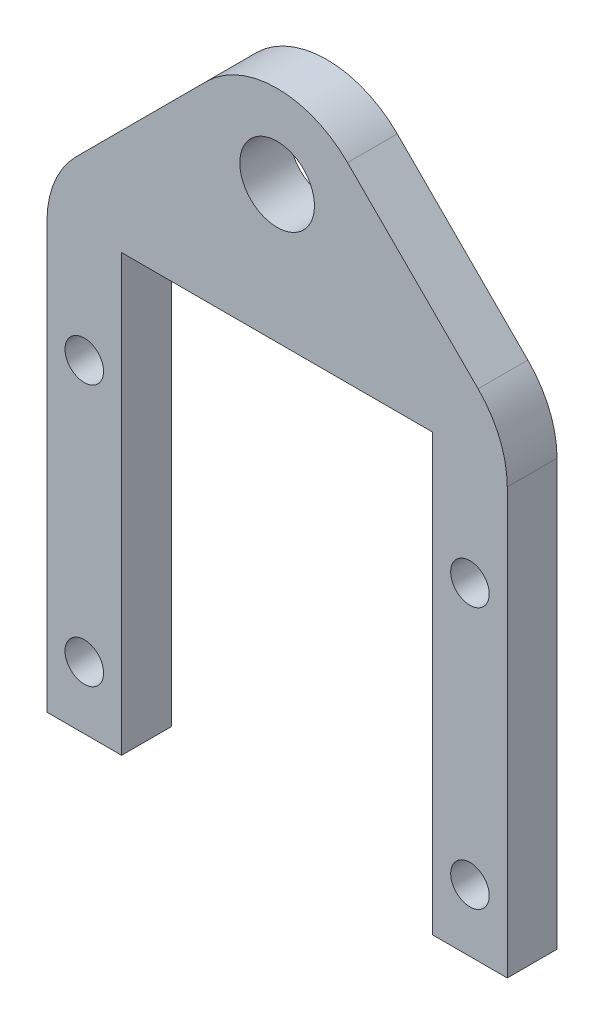
from build123d import *

# Parameters (mm, degrees)
SKETCH_1_R      = 3
SKETCH_1_R_2    = 1.55
EXTRUDE_1_DEPTH = 4
FILLET_1_R      = 8


with BuildPart() as part:
    # 草图1 → 凸台-拉伸1 (new body)
    with BuildSketch(Plane.XY):
        Polygon((-12.5, 0), (-18.5, 0), (-18.5, 37.5), (0, 56), (18.5, 37.5), (18.5, 0), (12.5, 0), (12.5, 35), (-12.5, 35), align=None)
        with Locations((0, 46)):
            Circle(SKETCH_1_R, mode=Mode.SUBTRACT)
        with Locations((-15.5, 5)):
            Circle(SKETCH_1_R_2, mode=Mode.SUBTRACT)
        with Locations((-15.5, 26)):
            Circle(SKETCH_1_R_2, mode=Mode.SUBTRACT)
        with Locations(Location((15.5, 5, 0), (0, 0, 180))):
            Circle(SKETCH_1_R_2, mode=Mode.SUBTRACT)
        with Locations(Location((15.5, 26, 0), (0, 0, 180))):
            Circle(SKETCH_1_R_2, mode=Mode.SUBTRACT)
    extrude(amount=EXTRUDE_1_DEPTH)

    # 圆角1
    fillet_1_edges = [part.edges().sort_by_distance(p)[0] for p in [
        (-18.5, 37.5, 2),
        (0, 56, 2),
        (18.5, 37.5, 2),
    ]]
    fillet(fillet_1_edges, radius=FILLET_1_R)


solid = part.part
